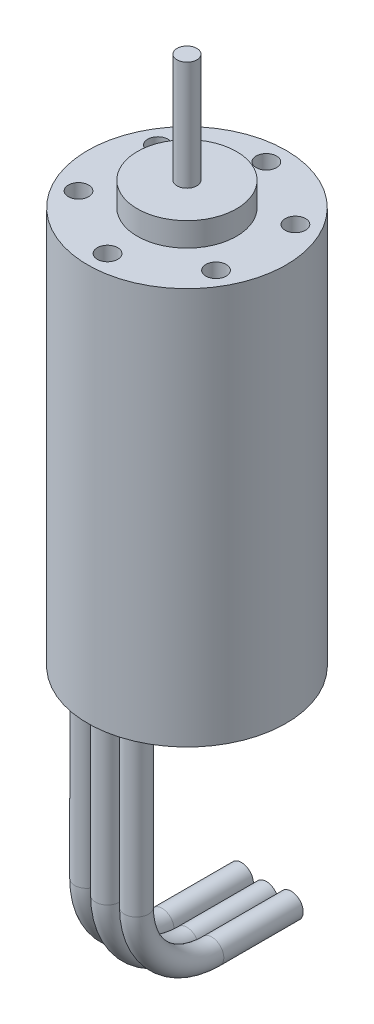
from build123d import *

# Parameters (mm, degrees)
CIRPATTERN1_COUNT = 6
SKETCH4_R         = 1.2065


with BuildPart() as part:
    # Sketch1 → Revolve1 (revolve)
    with BuildSketch(Plane.XY, mode=Mode.PRIVATE) as revolve1_sk:
        Polygon((0, 55.8), (1, 55.8), (1, 44.8), (5, 44.8), (5, 42.4), (10, 42.4), (10, 2.4), (5, 2.4), (5, 0), (0, 0), align=None)
    revolve(revolve1_sk.sketch.rotate(Axis((0, 0, 0), (0, 1, 0)), 90), axis=Axis((0, 0, 0), (0, 1, 0)))

    # Sketch2 → M2.5x0.45 Tapped Hole1 (revolve, cut)
    with BuildSketch(Plane(origin=(0, 42.4, -8), x_dir=(0, 0, 1), z_dir=(1, 0, 0))):
        Polygon((0, 0), (0, 4.615874135), (1.025, 3.999992), (1.025, 0), align=None)
    m2_5x0_45_tapped_hole1 = revolve(axis=Axis((0, 48.75, -8), (0, -1, 0)), mode=Mode.SUBTRACT)

    # CirPattern1: M2.5x0.45 Tapped Hole1 ×6 about axis
    cirpattern1_axis = Axis((0, 0, 0), (0, 1, 0))
    for i in range(1, CIRPATTERN1_COUNT):
        add(m2_5x0_45_tapped_hole1.rotate(cirpattern1_axis, i * 360 / CIRPATTERN1_COUNT), mode=Mode.SUBTRACT)

    # Sweep1: sweep along a path in Sketch5
    with BuildLine(Plane(origin=(0, 0, 0), x_dir=(0, 0, -1), z_dir=(1, 0, 0))) as sweep1_path:
        Line((-8, 2.4), (-8, -13.6))
        ThreePointArc((-8, -13.6), (-5.656854249, -19.256854249), (0, -21.6))
        Line((0, -21.6), (8, -21.6))
    # Sketch4 → Sweep1 (sweep)
    with BuildSketch(Plane(origin=(0, 2.4, 0), x_dir=(-1, 0, 0), z_dir=(0, -1, 0))):
        with Locations((-2.507789784, -7.596775)):
            Circle(SKETCH4_R)
        with Locations((0, -8)):
            Circle(SKETCH4_R)
        with Locations((2.507789784, -7.596775)):
            Circle(SKETCH4_R)
    sweep(path=sweep1_path.line)


solid = part.part
